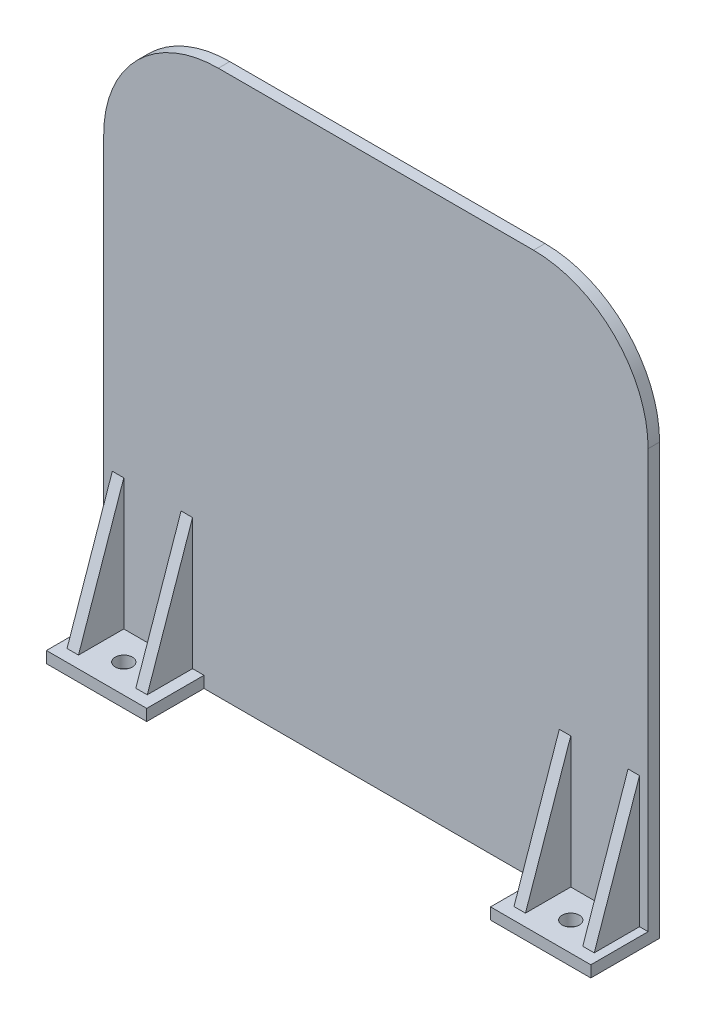
from build123d import *

# Parameters (mm, degrees)
SKETCH_1_W             = 95
SKETCH_1_H             = 95
EXTRUDE_1_DEPTH        = 2
SKETCH_2_W             = 95
SKETCH_2_H             = 2
EXTRUDE_2_DEPTH        = 10
FILLET_1_R             = 20
SKETCH_3_W             = 60
SKETCH_3_H             = 10
CUT_EXTRUDE_1_DEPTH    = 106.115412761
EXTRUDE_START          = 33
EXTRUDE_3_DEPTH        = 1
PATTERN_LINEAR_1_COUNT = 2
PATTERN_LINEAR_1_PITCH = 12
MIRROR_START           = 33
MIRROR_1_COPY_1_DEPTH  = 1
SKETCH_7_R             = 1.5
CUT_EXTRUDE_2_DEPTH    = 2


with BuildPart() as part:
    # 草图1 → 凸台-拉伸1 (new body)
    with BuildSketch(Plane.XY):
        Rectangle(SKETCH_1_W, SKETCH_1_H)
    extrude(amount=EXTRUDE_1_DEPTH)

    # 草图2 → 凸台-拉伸2 (add)
    with BuildSketch(Plane.XY.offset(2)):
        with Locations((0, -46.5)):
            Rectangle(SKETCH_2_W, SKETCH_2_H)
    extrude(amount=EXTRUDE_2_DEPTH)

    # 圆角1
    fillet_1_edges = [part.edges().sort_by_distance(p)[0] for p in [
        (-47.5, 47.5, 1),
        (47.5, 47.5, 1),
    ]]
    fillet(fillet_1_edges, radius=FILLET_1_R)

    # 草图3 → 切除-拉伸1 (cut, through all)
    with BuildSketch(Plane(origin=(0, -45.5, 0), x_dir=(1, 0, 0), z_dir=(0, 1, 0))):
        with Locations((0, -7)):
            Rectangle(SKETCH_3_W, SKETCH_3_H)
    extrude(amount=-CUT_EXTRUDE_1_DEPTH, mode=Mode.SUBTRACT)

    # 草图5 → 凸台-拉伸3 (add, symmetric)
    with BuildSketch(Plane(origin=(0, 0, 0), x_dir=(0, 0, -1), z_dir=(1, 0, 0)).offset(EXTRUDE_START)):
        Polygon((-1.499876111, -46.213636553), (-1.499876111, -21.213636553), (-10.151701689, -46.213636553), align=None)
    extrude_3 = extrude(amount=EXTRUDE_3_DEPTH, both=True)

    # 阵列(线性)1: 凸台-拉伸3 ×2
    with Locations(*[(i * PATTERN_LINEAR_1_PITCH, 0, 0) for i in range(1, PATTERN_LINEAR_1_COUNT)]):
        add(extrude_3)

    # 镜向1: 凸台-拉伸3 across plane
    add(extrude_3.mirror(Plane(origin=(0, 0, 0), x_dir=(0, 0, 1), z_dir=(1, 0, 0))))

    # 镜向1 copy 1 sketch → 镜向1 copy 1 (add, symmetric)
    with BuildSketch(Plane(origin=(-12, 0, 0), x_dir=(0, 0, -1), z_dir=(-1, 0, 0)).offset(MIRROR_START)):
        Polygon((-1.499876111, 46.213636553), (-1.499876111, 21.213636553), (-10.151701689, 46.213636553), align=None)
    extrude(amount=MIRROR_1_COPY_1_DEPTH, both=True)

    # 草图7 → 切除-拉伸2 (cut)
    with BuildSketch(Plane(origin=(0, -45.5, 0), x_dir=(1, 0, 0), z_dir=(0, 1, 0))):
        with Locations(Location((-39, -7, 0), (0, 0, 270))):
            Circle(SKETCH_7_R)
        with Locations(Location((39, -7, 0), (0, 0, 90))):
            Circle(SKETCH_7_R)
    extrude(amount=-CUT_EXTRUDE_2_DEPTH, mode=Mode.SUBTRACT)


solid = part.part
